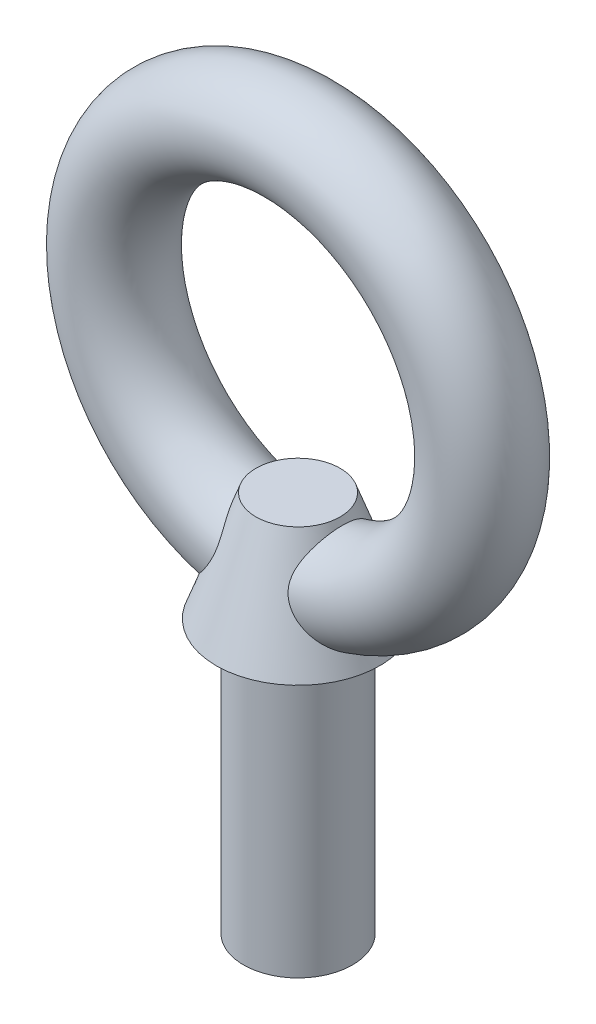
from build123d import *
from build123d.topology import SkipClean

# Parameters (mm, degrees)
ESQUISSE2_R        = 1.75
BOSS_EXTRU_1_START = -8.5
ESQUISSE3_R        = 3
BOSS_EXTRU_1_DEPTH = 4
BOSS_EXTRU_1_TAPER = 20
ESQUISSE4_R        = 2
BOSS_EXTRU_2_DEPTH = 10


with BuildPart() as part:
    # Esquisse2 → Révolution1 (revolve)
    with BuildSketch(Plane(origin=(0, 0, 0), x_dir=(1, 0, 0), z_dir=(0, 1, 0))):
        with Locations((6.75, 0)):
            Circle(ESQUISSE2_R)
    revolve(axis=Axis((0, 0, 0), (0, 0, -1)))



with BuildPart() as body_2:
    # Esquisse3 → Boss.-Extru.1 (new body)
    with BuildSketch(Plane(origin=(0, 0, 0), x_dir=(1, 0, 0), z_dir=(0, 1, 0)).offset(BOSS_EXTRU_1_START)):
        Circle(ESQUISSE3_R)
    extrude(amount=BOSS_EXTRU_1_DEPTH, taper=BOSS_EXTRU_1_TAPER)


with BuildPart() as part_1:
    with SkipClean():  # the faces are left unmerged after this step: merging them gives an invalid solid
        add(part.part)

        add(body_2.part)  # Boss.-Extru.2 merges body 2
        # Esquisse4 → Boss.-Extru.2 (add)
        with BuildSketch(Plane.XZ.offset(8.5)):
            with Locations(Location((0, 0, 0), (0, 0, 270))):
                Circle(ESQUISSE4_R)
        extrude(amount=BOSS_EXTRU_2_DEPTH)


solid = part_1.part
